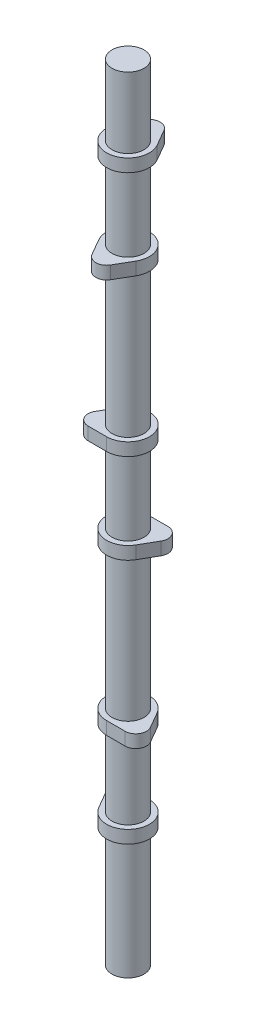
from build123d import *

# Parameters (mm, degrees)
BOSS_EXTRUDE1_DEPTH   = 7.62
LPATTERN1_COUNT       = 2
LPATTERN1_PITCH       = 53.34
BODY_MOVE_COPY1_ANGLE = 180
LPATTERN2_COUNT       = 3
LPATTERN2_PITCH       = 146.05
BODY_MOVE_COPY2_ANGLE = 120
BODY_MOVE_COPY3_ANGLE = 120
BOSS_EXTRUDE2_START   = 49.53
SKETCH2_R             = 9.5
BOSS_EXTRUDE2_DEPTH   = 466.09


with BuildPart() as part:
    # Sketch1 → Boss-Extrude1 (new body)
    with BuildSketch(Plane(origin=(0, 0, 0), x_dir=(1, 0, 0), z_dir=(0, 1, 0))):
        with BuildLine():
            Line((-5.499261314, 15.875), (-10.998522628, 6.35))
            ThreePointArc((-10.998522628, 6.35), (0, -12.7), (10.998522628, 6.35))
            Line((10.998522628, 6.35), (5.499261314, 15.875))
            ThreePointArc((5.499261314, 15.875), (0, 19.05), (-5.499261314, 15.875))
        make_face()
    extrude(amount=BOSS_EXTRUDE1_DEPTH)


with BuildPart() as lpattern1_1:
    # LPattern1: pattern copy
    add(part.part.moved(Location(Vector(0, -1, 0) * (1 * LPATTERN1_PITCH))))


with BuildPart() as lpattern1_1_1:
    # Body-Move/Copy1: moved
    add(lpattern1_1.part.rotate(Axis((0, 0, 0), (0, 1, 0)), BODY_MOVE_COPY1_ANGLE))


with BuildPart() as lpattern2_1:
    # LPattern2: pattern copy
    add(lpattern1_1_1.part.moved(Location(Vector(0, -1, 0) * (1 * LPATTERN2_PITCH))))


with BuildPart() as lpattern2_2:
    # LPattern2: pattern copy
    add(lpattern1_1_1.part.moved(Location(Vector(0, -1, 0) * (2 * LPATTERN2_PITCH))))


with BuildPart() as lpattern2_3:
    # LPattern2: pattern copy
    add(part.part.moved(Location(Vector(0, -1, 0) * (1 * LPATTERN2_PITCH))))


with BuildPart() as lpattern2_4:
    # LPattern2: pattern copy
    add(part.part.moved(Location(Vector(0, -1, 0) * (2 * LPATTERN2_PITCH))))


with BuildPart() as lpattern2_3_1:
    # Body-Move/Copy2: moved
    add(lpattern2_3.part.rotate(Axis((0, 0, 0), (0, 1, 0)), BODY_MOVE_COPY2_ANGLE))


with BuildPart() as lpattern2_1_1:
    # Body-Move/Copy2: moved
    add(lpattern2_1.part.rotate(Axis((0, 0, 0), (0, 1, 0)), BODY_MOVE_COPY2_ANGLE))



with BuildPart() as lpattern2_2_1:
    # Body-Move/Copy3: moved
    add(lpattern2_2.part.rotate(Axis((0, 0, 0), (0, -1, 0)), BODY_MOVE_COPY3_ANGLE))


with BuildPart() as lpattern2_4_1:
    # Body-Move/Copy3: moved
    add(lpattern2_4.part.rotate(Axis((0, 0, 0), (0, -1, 0)), BODY_MOVE_COPY3_ANGLE))


with BuildPart() as lpattern2_1_2:
    add(lpattern2_1_1.part)

    add(lpattern2_2_1.part)  # Boss-Extrude2 merges LPattern2_2

    add(lpattern2_3_1.part)  # Boss-Extrude2 merges LPattern2_3

    add(lpattern2_4_1.part)  # Boss-Extrude2 merges LPattern2_4
    # Sketch2 → Boss-Extrude2 (add)
    with BuildSketch(Plane(origin=(0, 0, 0), x_dir=(1, 0, 0), z_dir=(0, 1, 0)).offset(BOSS_EXTRUDE2_START)):
        with Locations(Location((0, 0, 0), (0, 0, 270))):
            Circle(SKETCH2_R)
    extrude(amount=-BOSS_EXTRUDE2_DEPTH)


solid = Compound([part.part, lpattern1_1_1.part, lpattern2_1_2.part])
